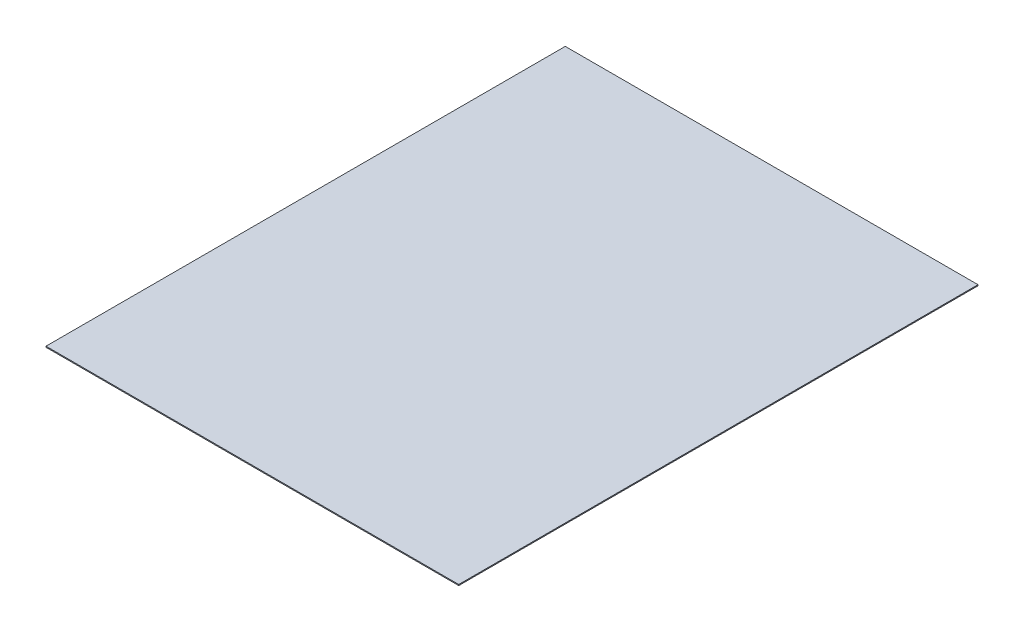
from build123d import *

# Parameters (mm, degrees)
PRESS_TEPSI_RAFI_RAF_1_START = -20
SKETCH1_W                    = 620
SKETCH1_H                    = 1.5
PRESS_TEPSI_RAFI_RAF_1_DEPTH = 780


with BuildPart() as part:
    # Sketch1 → PRESS_tepsi_rafi_raf_1 (new body)
    with BuildSketch(Plane.XY.offset(PRESS_TEPSI_RAFI_RAF_1_START)):
        with Locations((350, 1072.75)):
            Rectangle(SKETCH1_W, SKETCH1_H)
    extrude(amount=-PRESS_TEPSI_RAFI_RAF_1_DEPTH)


solid = part.part
